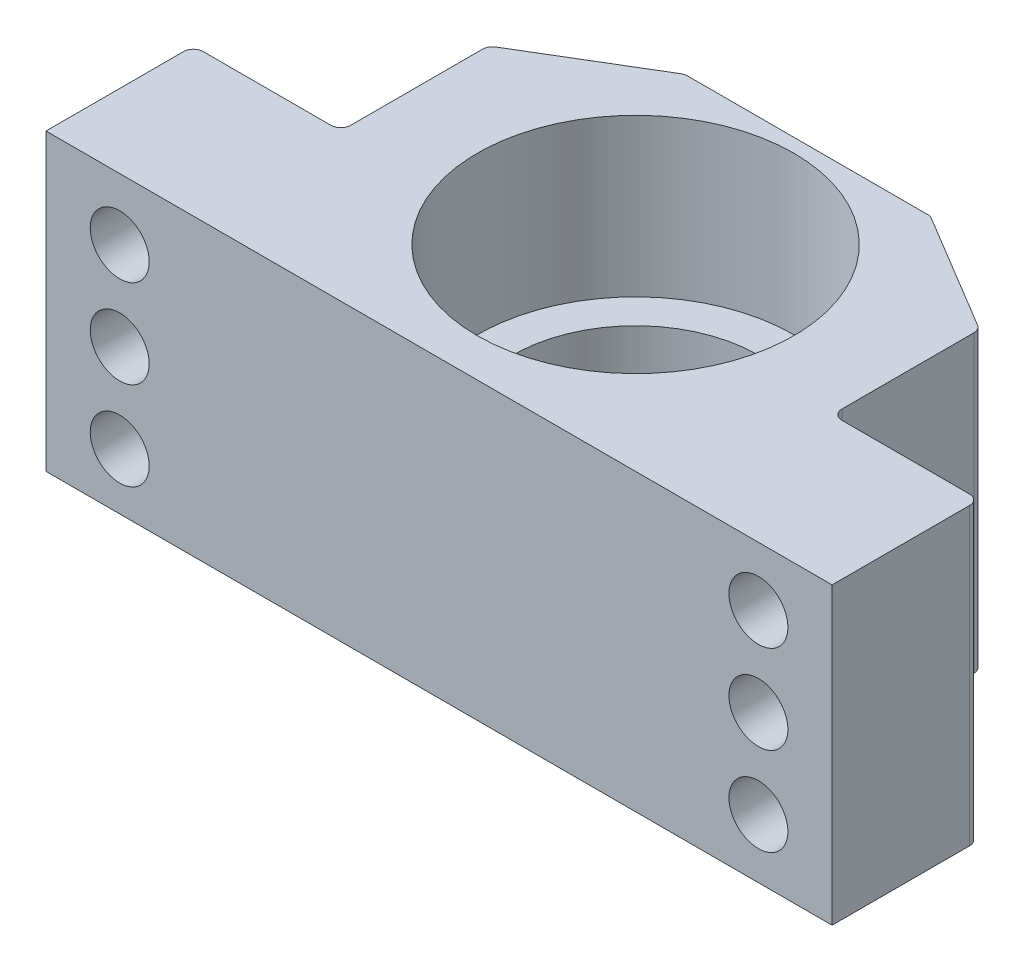
from build123d import *

# Parameters (mm, degrees)
BOSS_EXTRUDE1_DEPTH = 30
SKETCH2_R           = 16.1
CUT_EXTRUDE1_DEPTH  = 16
SKETCH6_R           = 12.5
CUT_EXTRUDE2_DEPTH  = 14
SKETCH8_R           = 3
CUT_EXTRUDE4_DEPTH  = 15
SKETCH9_R           = 3
CUT_EXTRUDE5_DEPTH  = 15
CUT_EXTRUDE6_DEPTH  = 30
CUT_EXTRUDE7_DEPTH  = 30
CUT_EXTRUDE8_DEPTH  = 30
FILLET2_R           = 1
FILLET3_R           = 1


with BuildPart() as part:
    # Sketch1 → Boss-Extrude1 (new body)
    with BuildSketch(Plane(origin=(0, 0, 0), x_dir=(1, 0, 0), z_dir=(0, 1, 0))):
        Polygon((0, 0), (40, 0), (40, 15), (25, 15), (25, 45), (-25, 45), (-25, 15), (-40, 15), (-40, 0), align=None)
    extrude(amount=BOSS_EXTRUDE1_DEPTH)

    # Sketch2 → Cut-Extrude1 (cut)
    with BuildSketch(Plane(origin=(0, 30, 0), x_dir=(1, 0, 0), z_dir=(0, 1, 0))):
        with Locations(Location((0, 20, 0), (0, 0, 270))):
            Circle(SKETCH2_R)
    extrude(amount=-CUT_EXTRUDE1_DEPTH, mode=Mode.SUBTRACT)

    # Sketch6 → Cut-Extrude2 (cut)
    with BuildSketch(Plane.XZ):
        with Locations(Location((0, -20, 0), (0, 0, 270))):
            Circle(SKETCH6_R)
    extrude(amount=-CUT_EXTRUDE2_DEPTH, mode=Mode.SUBTRACT)

    # Sketch8 → Cut-Extrude4 (cut)
    with BuildSketch(Plane(origin=(0, 0, -15), x_dir=(-1, 0, 0), z_dir=(0, 0, -1))):
        with Locations((-32.5, 6)):
            Circle(SKETCH8_R)
        with Locations((-32.5, 15)):
            Circle(SKETCH8_R)
        with Locations((-32.5, 24)):
            Circle(SKETCH8_R)
    extrude(amount=-CUT_EXTRUDE4_DEPTH, mode=Mode.SUBTRACT)

    # Sketch9 → Cut-Extrude5 (cut)
    with BuildSketch(Plane(origin=(0, 0, -15), x_dir=(-1, 0, 0), z_dir=(0, 0, -1))):
        with Locations((32.5, 23.72166378)):
            Circle(SKETCH9_R)
        with Locations((32.5, 14.72166378)):
            Circle(SKETCH9_R)
        with Locations((32.5, 5.72166378)):
            Circle(SKETCH9_R)
    extrude(amount=-CUT_EXTRUDE5_DEPTH, mode=Mode.SUBTRACT)

    # Sketch11 → Cut-Extrude6 (cut)
    with BuildSketch(Plane(origin=(0, 30, 0), x_dir=(1, 0, 0), z_dir=(0, 1, 0))):
        Polygon((-25, 30), (-25, 45), (0, 45), align=None)
    extrude(amount=-CUT_EXTRUDE6_DEPTH, mode=Mode.SUBTRACT)

    # Sketch12 → Cut-Extrude7 (cut)
    with BuildSketch(Plane(origin=(0, 30, 0), x_dir=(1, 0, 0), z_dir=(0, 1, 0))):
        Polygon((25, 30), (0, 45), (25, 45), align=None)
    extrude(amount=-CUT_EXTRUDE7_DEPTH, mode=Mode.SUBTRACT)

    # Sketch13 → Cut-Extrude8 (cut)
    with BuildSketch(Plane(origin=(0, 30, 0), x_dir=(1, 0, 0), z_dir=(0, 1, 0))):
        Polygon((-12.5, 37.5), (12.5, 37.5), (0, 45), align=None)
    extrude(amount=-CUT_EXTRUDE8_DEPTH, mode=Mode.SUBTRACT)

    # Fillet2
    fillet2_edges = [part.edges().sort_by_distance(p)[0] for p in [
        (-25, 15, -15),
    ]]
    fillet(fillet2_edges, radius=FILLET2_R)

    # Fillet3
    fillet3_edges = [part.edges().sort_by_distance(p)[0] for p in [
        (-40, 15, -15),
        (25, 15, -15),
        (40, 15, -15),
        (-25, 15, -30),
        (25, 15, -30),
        (-12.5, 15, -37.5),
        (12.5, 15, -37.5),
    ]]
    fillet(fillet3_edges, radius=FILLET3_R)


solid = part.part
